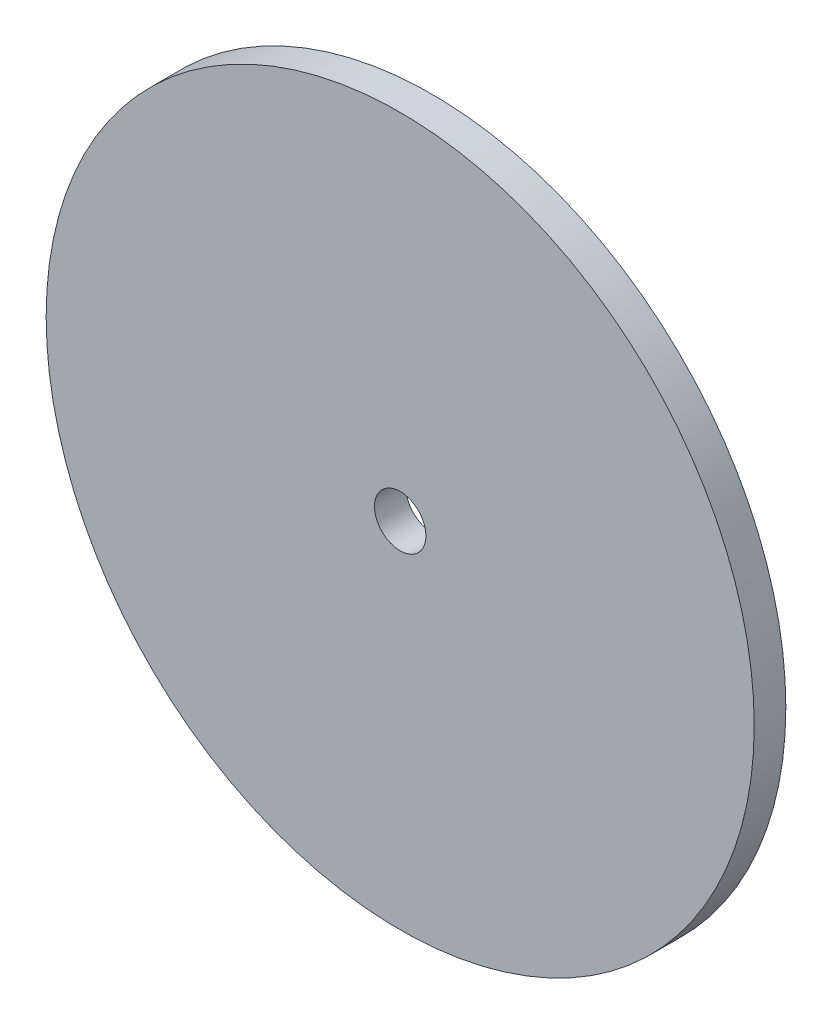
from build123d import *

# Parameters (mm, degrees)
SKETCH1_R           = 35.56
SKETCH1_R_2         = 2.5828
BOSS_EXTRUDE1_DEPTH = 3.175


with BuildPart() as part:
    # Sketch1 → Boss-Extrude1 (new body)
    with BuildSketch(Plane.XY):
        with Locations((-72.334844907, 41.077558686)):
            Circle(SKETCH1_R)
        with Locations((-72.334844907, 41.077558686)):
            Circle(SKETCH1_R_2, mode=Mode.SUBTRACT)
    extrude(amount=BOSS_EXTRUDE1_DEPTH)


solid = part.part
